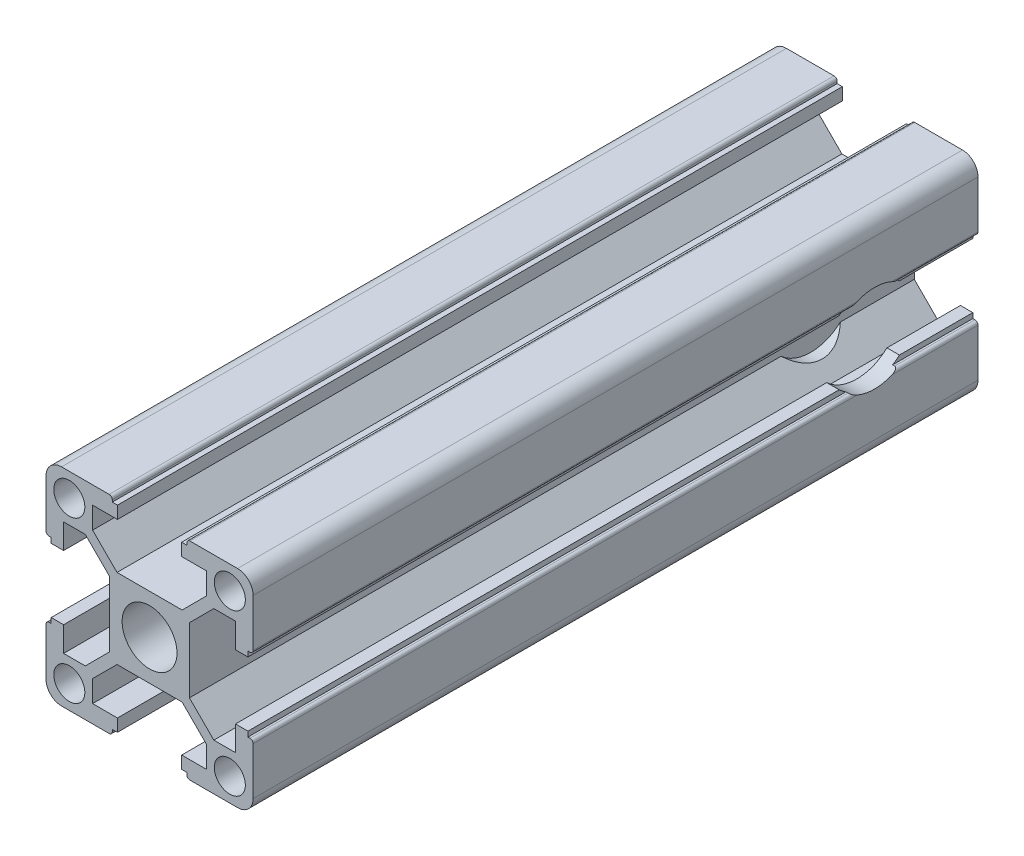
from build123d import *

# Parameters (mm, degrees)
SKETCH_1_R               = 2.65
SKETCH_1_R_2             = 1.5
EXTRUDE_1_DEPTH          = 35
CUT_EXTRUDE_1_DEPTH      = 38.749172176
CUT_EXTRUDE_1_DEPTH_BACK = 38.749172176
SKETCH_3_R               = 2
SKETCH_4_R               = 4.25
CUT_EXTRUDE_2_DEPTH      = 39.946405572
CUT_EXTRUDE_3_DEPTH      = 38.749172296
CUT_EXTRUDE_3_DEPTH_BACK = 38.749172296
SKETCH_5_R               = 2
SKETCH_6_R               = 4.25
CUT_EXTRUDE_4_DEPTH      = 39.946405598


with BuildPart() as part:
    # 草图1 → 凸台-拉伸1 (new, symmetric)
    with BuildSketch(Plane.XY):
        with BuildLine():
            Line((3.142893219, 3.85), (-3.142893219, 3.85))
            Line((-3.142893219, 3.85), (-5.5, 6.207106781))
            Line((-5.5, 6.207106781), (-5.5, 8.3))
            Line((-5.5, 8.3), (-3.1, 8.3))
            Line((-3.1, 8.3), (-3.1, 9.5))
            Line((-3.1, 9.5), (-3.6, 9.5))
            Line((-3.6, 9.5), (-3.6, 9.7))
            ThreePointArc((-3.6, 9.7), (-3.687867966, 9.912132034), (-3.9, 10))
            Line((-3.9, 10), (-8.5, 10))
            ThreePointArc((-8.5, 10), (-9.560660172, 9.560660172), (-10, 8.5))
            Line((-10, 8.5), (-10, 3.9))
            ThreePointArc((-10, 3.9), (-9.912132034, 3.687867966), (-9.7, 3.6))
            Line((-9.7, 3.6), (-9.5, 3.6))
            Line((-9.5, 3.6), (-9.5, 3.1))
            Line((-9.5, 3.1), (-8.3, 3.1))
            Line((-8.3, 3.1), (-8.3, 5.5))
            Line((-8.3, 5.5), (-6.207106781, 5.5))
            Line((-6.207106781, 5.5), (-3.85, 3.142893219))
            Line((-3.85, 3.142893219), (-3.85, -3.142893219))
            Line((-3.85, -3.142893219), (-6.207106781, -5.5))
            Line((-6.207106781, -5.5), (-8.3, -5.5))
            Line((-8.3, -5.5), (-8.3, -3.1))
            Line((-8.3, -3.1), (-9.5, -3.1))
            Line((-9.5, -3.1), (-9.5, -3.6))
            Line((-9.5, -3.6), (-9.7, -3.6))
            ThreePointArc((-9.7, -3.6), (-9.912132034, -3.687867966), (-10, -3.9))
            Line((-10, -3.9), (-10, -8.5))
            ThreePointArc((-10, -8.5), (-9.560660172, -9.560660172), (-8.5, -10))
            Line((-8.5, -10), (-3.9, -10))
            ThreePointArc((-3.9, -10), (-3.687867966, -9.912132034), (-3.6, -9.7))
            Line((-3.6, -9.7), (-3.6, -9.5))
            Line((-3.6, -9.5), (-3.1, -9.5))
            Line((-3.1, -9.5), (-3.1, -8.3))
            Line((-3.1, -8.3), (-5.5, -8.3))
            Line((-5.5, -8.3), (-5.5, -6.207106781))
            Line((-5.5, -6.207106781), (-3.142893219, -3.85))
            Line((-3.142893219, -3.85), (3.142893219, -3.85))
            Line((3.142893219, -3.85), (5.5, -6.207106781))
            Line((5.5, -6.207106781), (5.5, -8.3))
            Line((5.5, -8.3), (3.1, -8.3))
            Line((3.1, -8.3), (3.1, -9.5))
            Line((3.1, -9.5), (3.6, -9.5))
            Line((3.6, -9.5), (3.6, -9.7))
            ThreePointArc((3.6, -9.7), (3.687867966, -9.912132034), (3.9, -10))
            Line((3.9, -10), (8.5, -10))
            ThreePointArc((8.5, -10), (9.560660172, -9.560660172), (10, -8.5))
            Line((10, -8.5), (10, -3.9))
            ThreePointArc((10, -3.9), (9.912132034, -3.687867966), (9.7, -3.6))
            Line((9.7, -3.6), (9.5, -3.6))
            Line((9.5, -3.6), (9.5, -3.1))
            Line((9.5, -3.1), (8.3, -3.1))
            Line((8.3, -3.1), (8.3, -5.5))
            Line((8.3, -5.5), (6.207106781, -5.5))
            Line((6.207106781, -5.5), (3.85, -3.142893219))
            Line((3.85, -3.142893219), (3.85, 3.142893219))
            Line((3.85, 3.142893219), (6.207106781, 5.5))
            Line((6.207106781, 5.5), (8.3, 5.5))
            Line((8.3, 5.5), (8.3, 3.1))
            Line((8.3, 3.1), (9.5, 3.1))
            Line((9.5, 3.1), (9.5, 3.6))
            Line((9.5, 3.6), (9.7, 3.6))
            ThreePointArc((9.7, 3.6), (9.912132034, 3.687867966), (10, 3.9))
            Line((10, 3.9), (10, 8.5))
            ThreePointArc((10, 8.5), (9.560660172, 9.560660172), (8.5, 10))
            Line((8.5, 10), (3.9, 10))
            ThreePointArc((3.9, 10), (3.687867966, 9.912132034), (3.6, 9.7))
            Line((3.6, 9.7), (3.6, 9.5))
            Line((3.6, 9.5), (3.1, 9.5))
            Line((3.1, 9.5), (3.1, 8.3))
            Line((3.1, 8.3), (5.5, 8.3))
            Line((5.5, 8.3), (5.5, 6.207106781))
            Line((5.5, 6.207106781), (3.142893219, 3.85))
        make_face()
        Circle(SKETCH_1_R, mode=Mode.SUBTRACT)
        with Locations((-7.75, 7.75)):
            Circle(SKETCH_1_R_2, mode=Mode.SUBTRACT)
        with Locations((7.75, 7.75)):
            Circle(SKETCH_1_R_2, mode=Mode.SUBTRACT)
        with Locations((7.75, -7.75)):
            Circle(SKETCH_1_R_2, mode=Mode.SUBTRACT)
        with Locations((-7.75, -7.75)):
            Circle(SKETCH_1_R_2, mode=Mode.SUBTRACT)
    extrude(amount=EXTRUDE_1_DEPTH, both=True)

    # 草图3 → 切除-拉伸1 (cut, two sides: drawn at the far end of the back side and taken through both)
    with BuildSketch(Plane(origin=(0, 0, 0), x_dir=(1, 0, 0), z_dir=(0, 1, 0)).offset(-CUT_EXTRUDE_1_DEPTH_BACK)):
        with Locations(Location((0, -13, 0), (0, 0, 270))):
            Circle(SKETCH_3_R)
    extrude(amount=CUT_EXTRUDE_1_DEPTH + CUT_EXTRUDE_1_DEPTH_BACK, mode=Mode.SUBTRACT)

    # 草图4 → 切除-拉伸2 (cut, through all)
    with BuildSketch(Plane.XZ.offset(3.85)):
        with Locations((0, 13)):
            Circle(SKETCH_4_R)
    extrude(amount=CUT_EXTRUDE_2_DEPTH, mode=Mode.SUBTRACT)

    # 草图5 → 切除-拉伸3 (cut, two sides: drawn at the far end of the back side and taken through both)
    with BuildSketch(Plane(origin=(0, 0, 0), x_dir=(0, 0, -1), z_dir=(1, 0, 0)).offset(-CUT_EXTRUDE_3_DEPTH_BACK)):
        with Locations(Location((25, 0, 0), (0, 0, 180))):
            Circle(SKETCH_5_R)
    extrude(amount=CUT_EXTRUDE_3_DEPTH + CUT_EXTRUDE_3_DEPTH_BACK, mode=Mode.SUBTRACT)

    # 草图6 → 切除-拉伸4 (cut, through all)
    with BuildSketch(Plane.ZY.offset(-3.85)):
        with Locations((-25, 0)):
            Circle(SKETCH_6_R)
    extrude(amount=-CUT_EXTRUDE_4_DEPTH, mode=Mode.SUBTRACT)


solid = part.part
